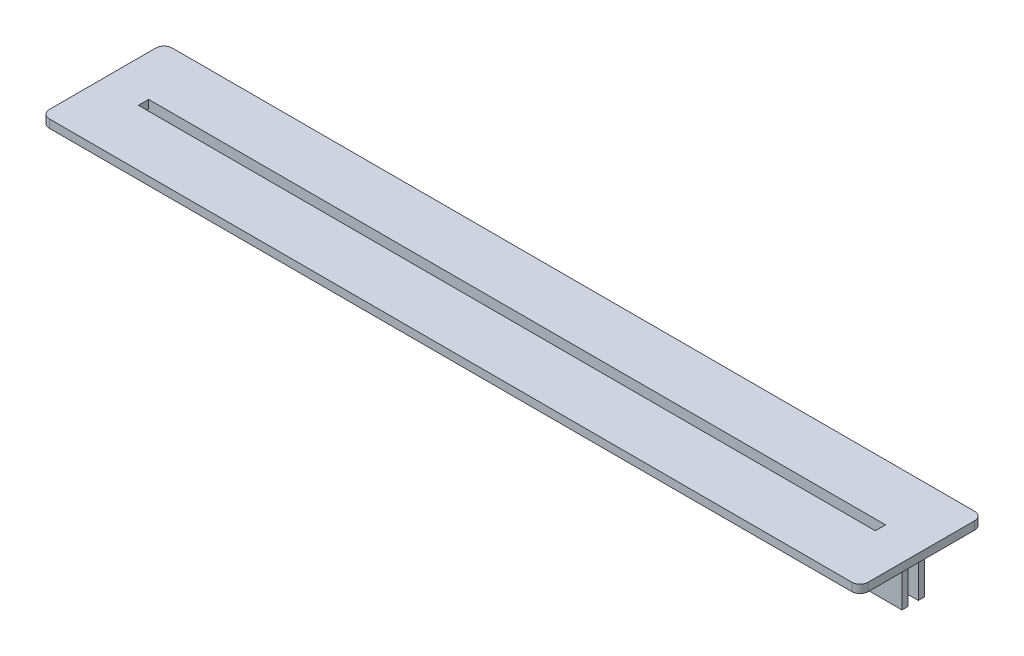
from build123d import *

# Parameters (mm, degrees)
BOSS_EXTRUDE1_DEPTH = 2.54
CUT_EXTRUDE1_START  = 2.54
SKETCH5_W           = 228.6
SKETCH5_H           = 3.175
CUT_EXTRUDE1_DEPTH  = 2.54
SKETCH6_W           = 248.92
SKETCH6_H           = 1.905
BOSS_EXTRUDE3_DEPTH = 12.7


with BuildPart() as part:
    # Sketch3 → Boss-Extrude1 (new body)
    with BuildSketch(Plane(origin=(0, 0, 0), x_dir=(1, 0, 0), z_dir=(0, 1, 0))):
        with BuildLine():
            Line((-124.46, 19.05), (124.46, 19.05))
            ThreePointArc((124.46, 19.05), (126.256051224, 18.306051224), (127, 16.51))
            Line((127, 16.51), (127, -16.51))
            ThreePointArc((127, -16.51), (126.256051224, -18.306051224), (124.46, -19.05))
            Line((124.46, -19.05), (-124.46, -19.05))
            ThreePointArc((-124.46, -19.05), (-126.256051224, -18.306051224), (-127, -16.51))
            Line((-127, -16.51), (-127, 16.51))
            ThreePointArc((-127, 16.51), (-126.256051224, 18.306051224), (-124.46, 19.05))
        make_face()
    extrude(amount=BOSS_EXTRUDE1_DEPTH)

    # Sketch5 → Cut-Extrude1 (cut)
    with BuildSketch(Plane(origin=(0, 0, 0), x_dir=(1, 0, 0), z_dir=(0, 1, 0)).offset(CUT_EXTRUDE1_START)):
        Rectangle(SKETCH5_W, SKETCH5_H)
    extrude(amount=-CUT_EXTRUDE1_DEPTH, mode=Mode.SUBTRACT)

    # Sketch6 → Boss-Extrude3 (add)
    with BuildSketch(Plane.XZ):
        with Locations((0, -2.54)):
            Rectangle(SKETCH6_W, SKETCH6_H)
        with Locations((0, 2.54)):
            Rectangle(SKETCH6_W, SKETCH6_H)
    extrude(amount=BOSS_EXTRUDE3_DEPTH)


solid = part.part
